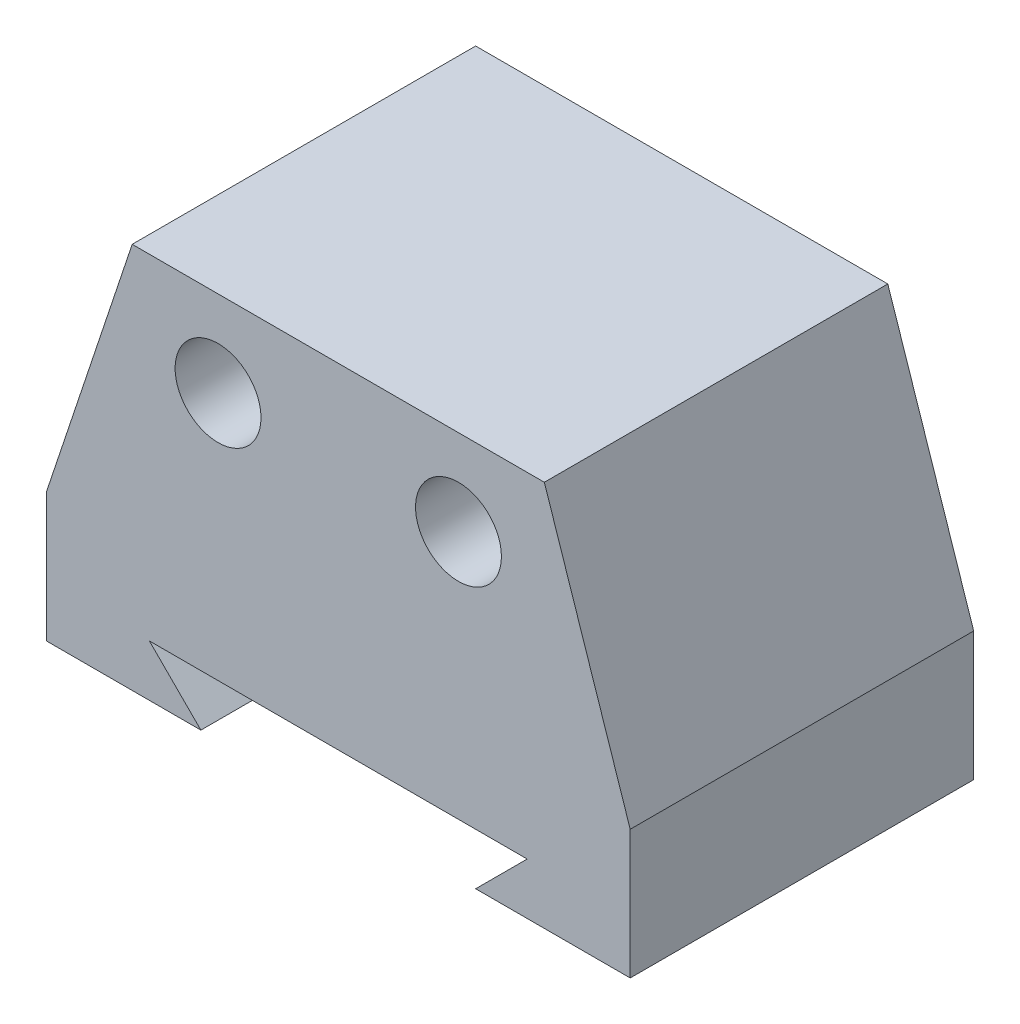
from build123d import *

# Parameters (mm, degrees)
SKETCH1_R           = 5
BOSS_EXTRUDE1_DEPTH = 40


with BuildPart() as part:
    # Sketch1 → Boss-Extrude1 (new body)
    with BuildSketch(Plane.XY):
        Polygon((-22, 6), (22, 6), (16, 0), (34, 0), (34, 15), (24, 45), (-24, 45), (-34, 15), (-34, 0), (-16, 0), align=None)
        with Locations((-14, 35)):
            Circle(SKETCH1_R, mode=Mode.SUBTRACT)
        with Locations((14, 35)):
            Circle(SKETCH1_R, mode=Mode.SUBTRACT)
    extrude(amount=BOSS_EXTRUDE1_DEPTH)


solid = part.part
